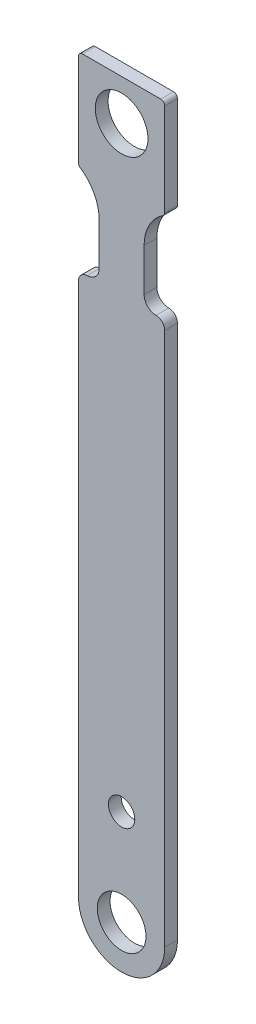
from build123d import *

# Parameters (mm, degrees)
SKETCH_2_R      = 1.525
SKETCH_2_R_2    = 0.825
SKETCH_2_R_3    = 1.65
EXTRUDE_1_DEPTH = 0.8


with BuildPart() as part:
    # 草图2 → 凸台-拉伸1 (new body)
    with BuildSketch(Plane.XY):
        with BuildLine():
            Line((-2.7, 33.467), (-2.7, 0))
            ThreePointArc((-2.7, 0), (0, -2.7), (2.7, 0))
            Line((2.7, 0), (2.7, 33.467))
            ThreePointArc((2.7, 33.467), (2.540401667, 33.854410039), (2.154230769, 34.016983728))
            ThreePointArc((2.154230769, 34.016983728), (1.627634091, 34.238675121), (1.41, 34.766961538))
            Line((1.41, 34.766961538), (1.41, 37.442))
            ThreePointArc((1.41, 37.442), (1.7232193, 38.69278444), (2.588946281, 39.648339169))
            ThreePointArc((2.588946281, 39.648339169), (2.670495544, 39.738349976), (2.7, 39.856170665))
            Line((2.7, 39.856170665), (2.7, 45.651))
            ThreePointArc((2.7, 45.651), (2.626776695, 45.827776695), (2.45, 45.901))
            Line((2.45, 45.901), (-2.45, 45.901))
            ThreePointArc((-2.45, 45.901), (-2.626776695, 45.827776695), (-2.7, 45.651))
            Line((-2.7, 45.651), (-2.7, 39.856170665))
            ThreePointArc((-2.7, 39.856170665), (-2.670495544, 39.738349976), (-2.588946281, 39.648339169))
            ThreePointArc((-2.588946281, 39.648339169), (-1.7232193, 38.69278444), (-1.41, 37.442))
            Line((-1.41, 37.442), (-1.41, 34.766961538))
            ThreePointArc((-1.41, 34.766961538), (-1.627634091, 34.238675121), (-2.154230769, 34.016983728))
            ThreePointArc((-2.154230769, 34.016983728), (-2.540401667, 33.854410039), (-2.7, 33.467))
        make_face()
        Circle(SKETCH_2_R, mode=Mode.SUBTRACT)
        with Locations((0, 6)):
            Circle(SKETCH_2_R_2, mode=Mode.SUBTRACT)
        with Locations((0, 43.351)):
            Circle(SKETCH_2_R_3, mode=Mode.SUBTRACT)
    extrude(amount=EXTRUDE_1_DEPTH)


solid = part.part
